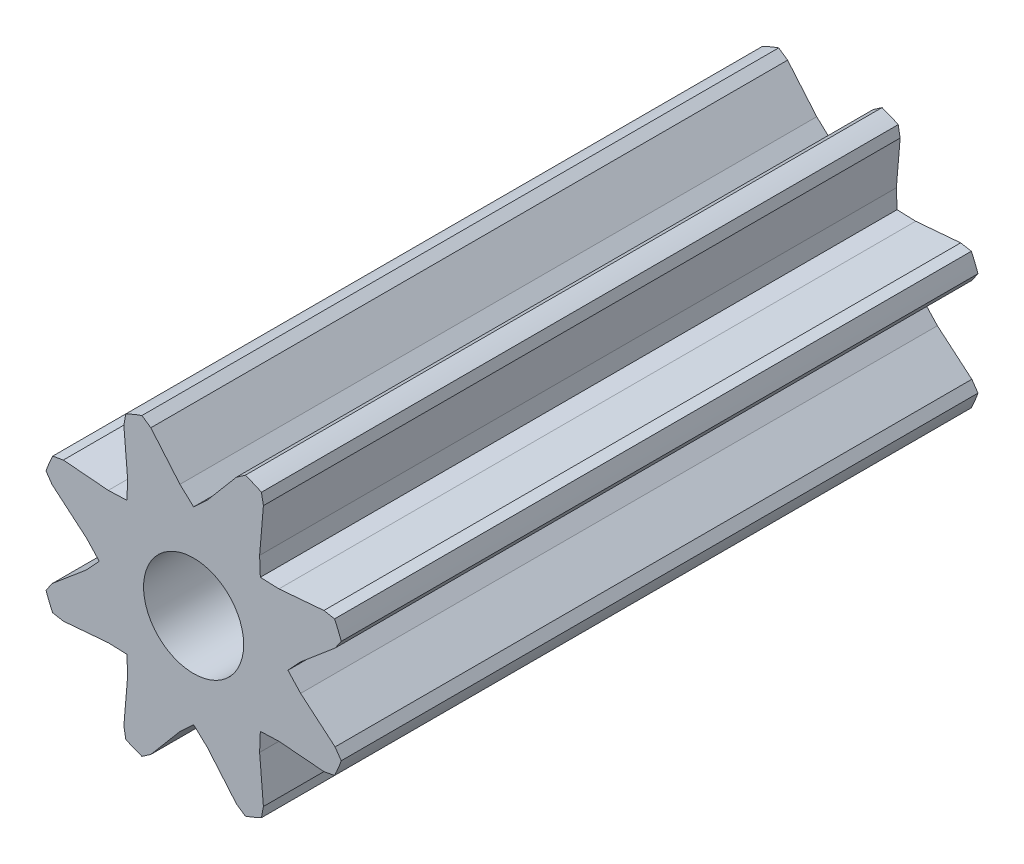
from build123d import *

# Parameters (mm, degrees)
SKETCH1_R               = 5
BOSS_EXTRUDE1_DEPTH     = 20.355
CUT_EXTRUDE1_DEPTH      = 22.548225565
CIRPATTERN1_COUNT       = 8
CUT_EXTRUDE2_DEPTH      = 22.421117005
CUT_EXTRUDE2_DEPTH_BACK = 22.421117005
SKETCH4_R               = 1.6


with BuildPart() as part:
    # Sketch1 → Boss-Extrude1 (new body)
    with BuildSketch(Plane.XY):
        Circle(SKETCH1_R)
    extrude(amount=BOSS_EXTRUDE1_DEPTH)

    # Sketch2 → Cut-Extrude1 (cut, through all)
    with BuildSketch(Plane.XY):
        Polygon((0, 3.015315818), (-0.43705364, 3.420638152), (-1.367879142, 4.521896493), (-1.652539145, 4.719016251), (-1.899055149, 5.271190713), (0, 6.265180055), (1.899055149, 5.271190713), (1.652539145, 4.719016251), (1.367879142, 4.521896493), (0.43705364, 3.420638152), align=None)
    cut_extrude1 = extrude(amount=CUT_EXTRUDE1_DEPTH, mode=Mode.SUBTRACT)

    # CirPattern1: Cut-Extrude1 ×8 about axis
    cirpattern1_axis = Axis((0, 0, 0), (0, 0, 1))
    for i in range(1, CIRPATTERN1_COUNT):
        add(cut_extrude1.rotate(cirpattern1_axis, i * 360 / CIRPATTERN1_COUNT), mode=Mode.SUBTRACT)

    # Sketch4 → Cut-Extrude2 (cut, two sides: drawn at the far end of the back side and taken through both)
    with BuildSketch(Plane.XY.offset(20.355).offset(-CUT_EXTRUDE2_DEPTH_BACK)):
        Circle(SKETCH4_R)
    extrude(amount=CUT_EXTRUDE2_DEPTH + CUT_EXTRUDE2_DEPTH_BACK, mode=Mode.SUBTRACT)


solid = part.part
